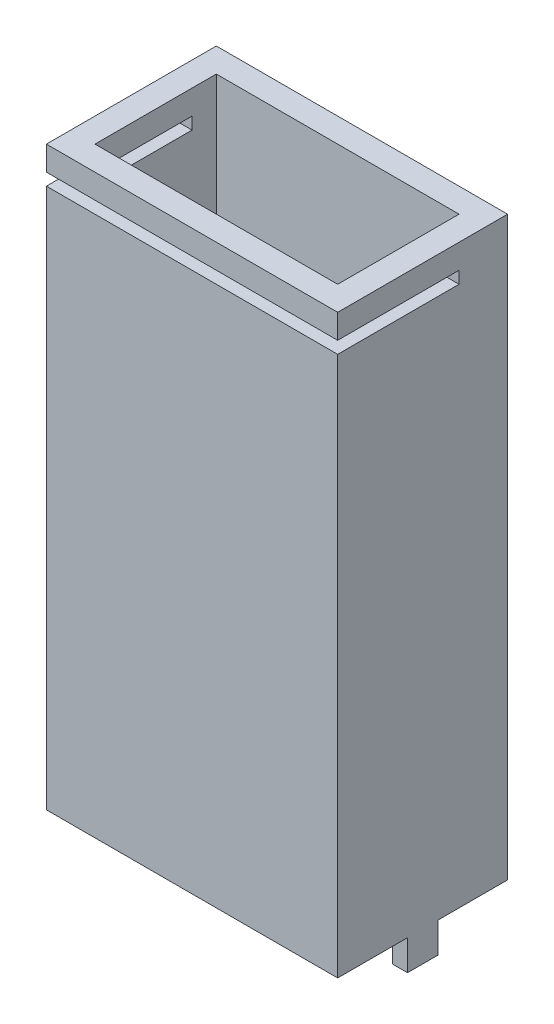
from build123d import *

# Parameters (mm, degrees)
SKETCH1_W           = 48
SKETCH1_H           = 28
SKETCH1_W_2         = 40
SKETCH1_H_2         = 20
BOSS_EXTRUDE1_DEPTH = 95
SKETCH6_W           = 2.5
SKETCH6_H           = 5
BOSS_EXTRUDE3_DEPTH = 5
SKETCH7_W           = 55.319039298
SKETCH7_H           = 2
CUT_EXTRUDE1_DEPTH  = 20


with BuildPart() as part:
    # Sketch1 → Boss-Extrude1 (new body)
    with BuildSketch(Plane(origin=(0, 0, 0), x_dir=(1, 0, 0), z_dir=(0, 1, 0))):
        with Locations((20, -10)):
            Rectangle(SKETCH1_W, SKETCH1_H)
        with Locations((20, -10)):
            Rectangle(SKETCH1_W_2, SKETCH1_H_2, mode=Mode.SUBTRACT)
    extrude(amount=BOSS_EXTRUDE1_DEPTH)

    # Sketch6 → Boss-Extrude3 (add)
    with BuildSketch(Plane.XZ):
        with Locations((-2.75, 10)):
            Rectangle(SKETCH6_W, SKETCH6_H)
        with Locations((42.75, 10)):
            Rectangle(SKETCH6_W, SKETCH6_H)
    extrude(amount=BOSS_EXTRUDE3_DEPTH)

    # Sketch7 → Cut-Extrude1 (cut)
    with BuildSketch(Plane.XY.offset(24)):
        with Locations((21.062221668, 90)):
            Rectangle(SKETCH7_W, SKETCH7_H)
    extrude(amount=-CUT_EXTRUDE1_DEPTH, mode=Mode.SUBTRACT)


solid = part.part
